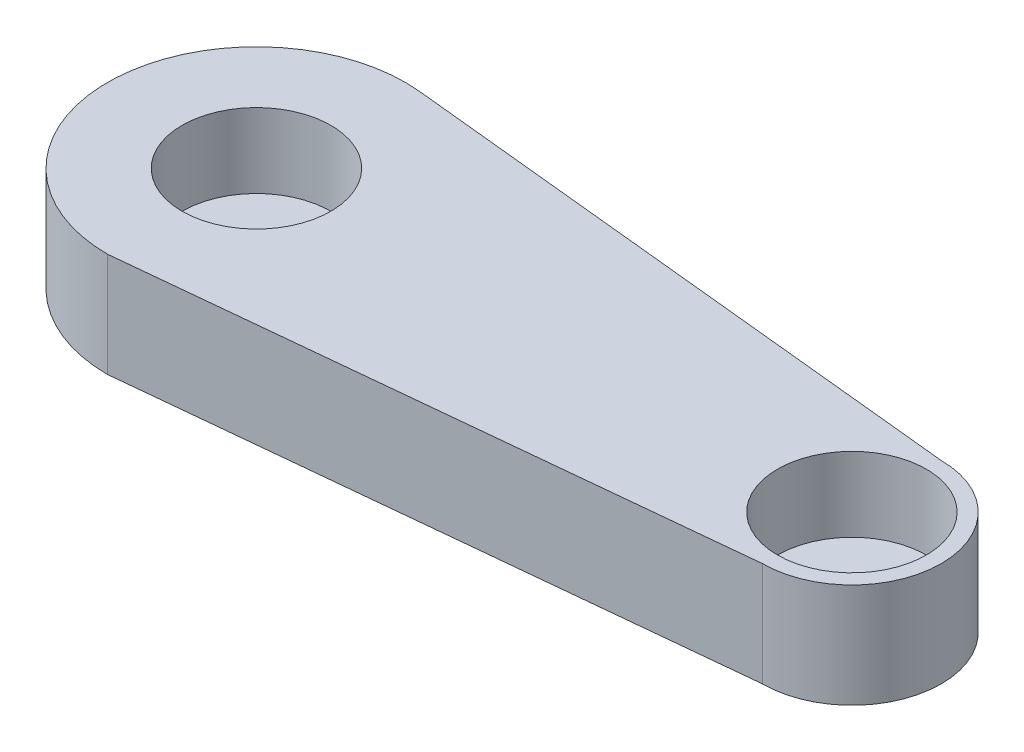
from build123d import *

# Parameters (mm, degrees)
BOSS_EXTRUDE1_DEPTH = 70
SKETCH3_R           = 50
CUT_EXTRUDE1_DEPTH  = 50


with BuildPart() as part:
    # Sketch2 → Boss-Extrude1 (new body)
    with BuildSketch(Plane(origin=(0, 0, 0), x_dir=(1, 0, 0), z_dir=(0, 1, 0))):
        with BuildLine():
            Line((295.019395576, 60), (-94.904260616, 99.491041282))
            ThreePointArc((-94.904260616, 99.491041282), (-204.853283691, 5.044594719), (-104.980604424, -100))
            Line((-104.980604424, -100), (-85.178624226, -98.01980198))
            Line((-85.178624226, -98.01980198), (295.019395576, -60))
            ThreePointArc((295.019395576, -60), (355.019395576, 0), (295.019395576, 60))
        make_face()
    extrude(amount=BOSS_EXTRUDE1_DEPTH)

    # Sketch3 → Cut-Extrude1 (cut)
    with BuildSketch(Plane(origin=(0, 70, 0), x_dir=(1, 0, 0), z_dir=(0, 1, 0))):
        with Locations(Location((-104.980604424, 0, 0), (0, 0, 270))):
            Circle(SKETCH3_R)
        with Locations(Location((295.019395576, 0, 0), (0, 0, 270))):
            Circle(SKETCH3_R)
    extrude(amount=-CUT_EXTRUDE1_DEPTH, mode=Mode.SUBTRACT)


solid = part.part
